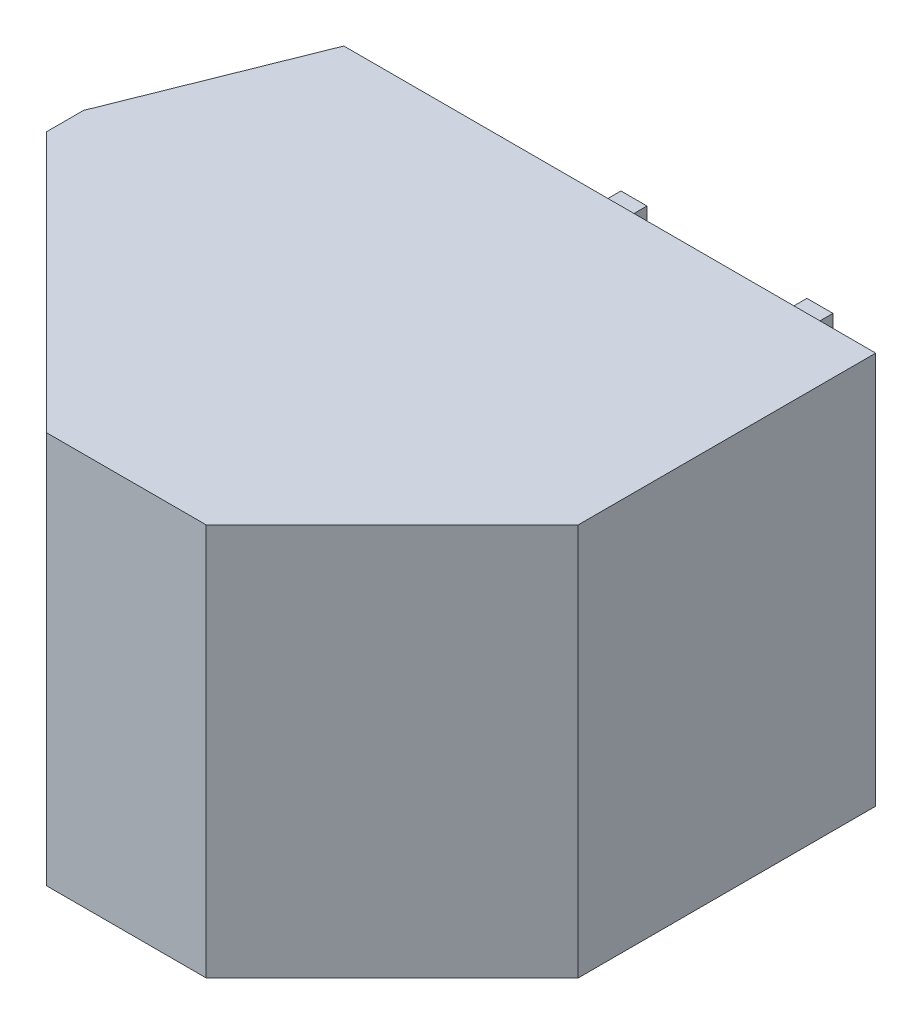
from build123d import *

# Parameters (mm, degrees)
SKETCH_1_W      = 16.3
SKETCH_1_H      = 10.55
EXTRUDE_1_DEPTH = 13
CHAMFER_1_SIZE  = 5
CHAMFER_3_SIZE  = 2
CHAMFER_3_SIZE2 = 5
CHAMFER_4_SIZE  = 7
SKETCH_2_W      = 0.7
SKETCH_2_H      = 0.7
EXTRUDE_2_DEPTH = 3.5


with BuildPart() as part:
    # Эскиз1 → Бобышка-Вытянуть1 (new body)
    with BuildSketch(Plane.XY):
        with Locations((8.15, 5.275)):
            Rectangle(SKETCH_1_W, SKETCH_1_H)
    extrude(amount=EXTRUDE_1_DEPTH)

    # Фаска1
    chamfer_1_edges = [part.edges().sort_by_distance(p)[0] for p in [
        (16.3, 5.275, 13),
    ]]
    chamfer(chamfer_1_edges, length=CHAMFER_1_SIZE)

    # Фаска3
    chamfer_3_edges = [part.edges().sort_by_distance(p)[0] for p in [
        (0, 5.275, 0),
    ]]
    chamfer_3_side = [part.faces().sort_by_distance(p)[0] for p in [
        (8.15, 5.275, 0),
    ]]
    chamfer(chamfer_3_edges, length=CHAMFER_3_SIZE, length2=CHAMFER_3_SIZE2, reference=chamfer_3_side[0])

    # Фаска4
    chamfer_4_edges = [part.edges().sort_by_distance(p)[0] for p in [
        (0, 5.275, 13),
    ]]
    chamfer(chamfer_4_edges, length=CHAMFER_4_SIZE)

    # Эскиз2 → Бобышка-Вытянуть2 (add)
    with BuildSketch(Plane(origin=(0, 0, 0), x_dir=(-1, 0, 0), z_dir=(0, 0, -1))):
        with Locations((-6.3, 2.05)):
            Rectangle(SKETCH_2_W, SKETCH_2_H)
        with Locations((-6.3, 7.05)):
            Rectangle(SKETCH_2_W, SKETCH_2_H)
        with Locations((-11.3, 2.05)):
            Rectangle(SKETCH_2_W, SKETCH_2_H)
        with Locations((-11.3, 7.05)):
            Rectangle(SKETCH_2_W, SKETCH_2_H)
    extrude(amount=EXTRUDE_2_DEPTH)


solid = part.part
